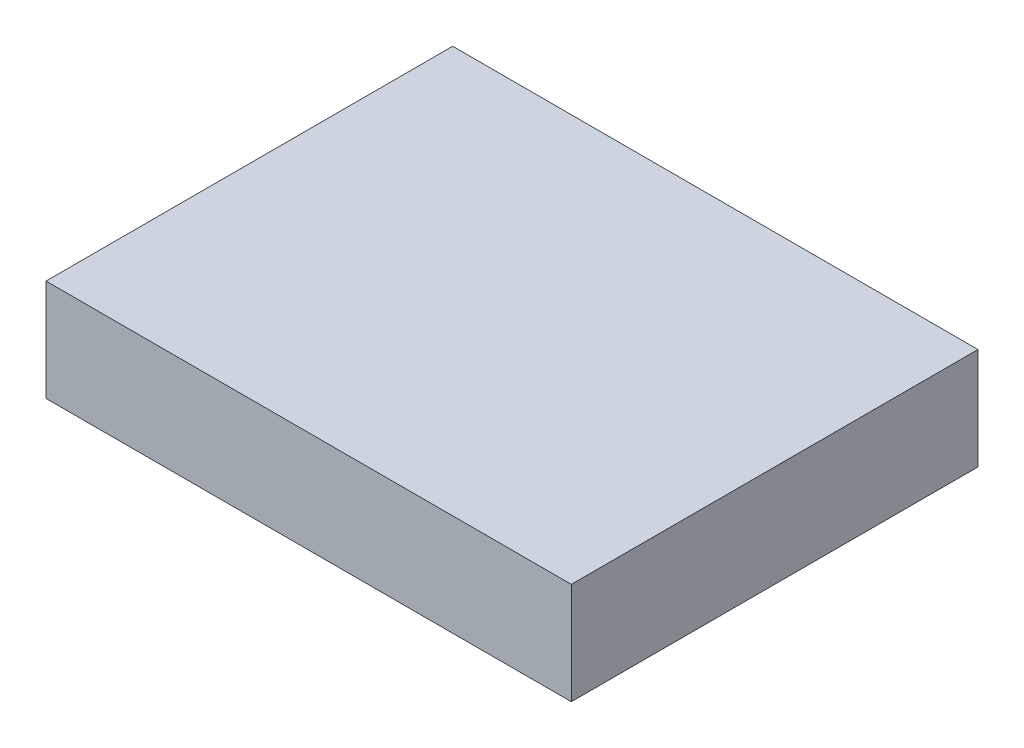
from build123d import *

# Parameters (mm, degrees)
SKETCH1_W           = 15.5
SKETCH1_H           = 12
BOSS_EXTRUDE1_DEPTH = 3


with BuildPart() as part:
    # Sketch1 → Boss-Extrude1 (new body)
    with BuildSketch(Plane(origin=(0, 0, 0), x_dir=(1, 0, 0), z_dir=(0, 1, 0))):
        Rectangle(SKETCH1_W, SKETCH1_H)
    extrude(amount=BOSS_EXTRUDE1_DEPTH)


solid = part.part
